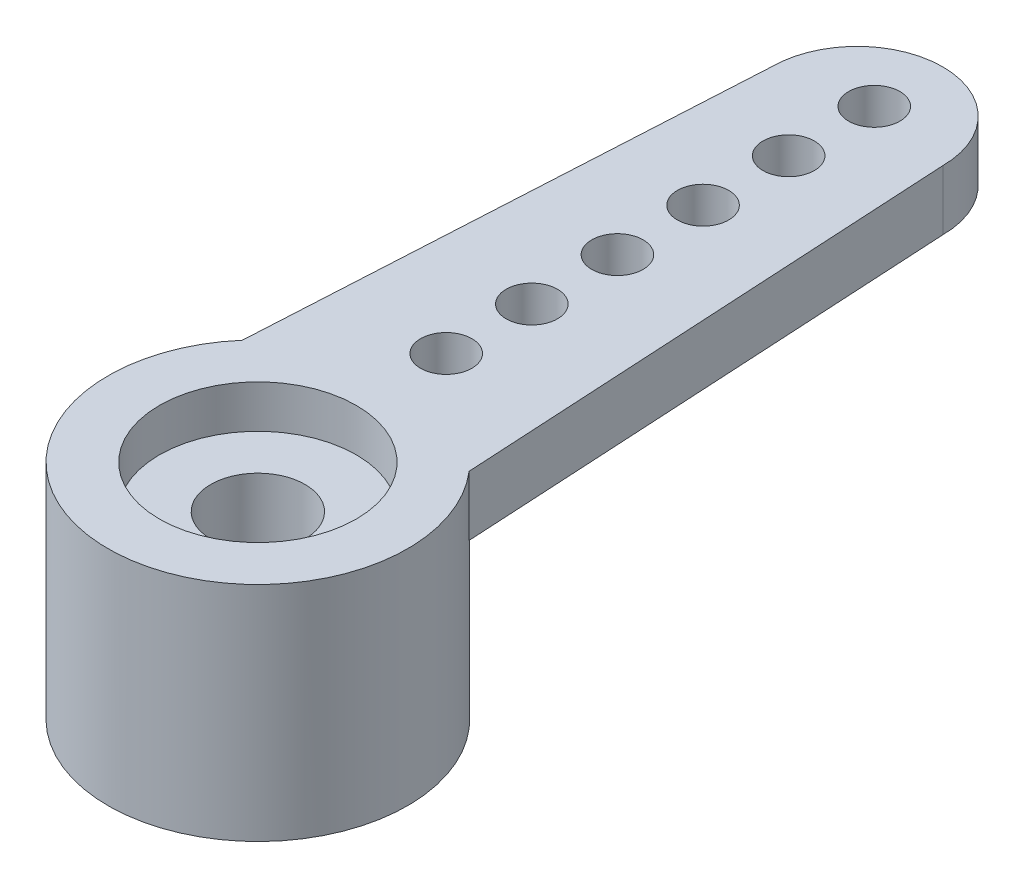
from build123d import *

# Parameters (mm, degrees)
BOSS_EXTRUDE1_DEPTH = 1.4
SKETCH2_R           = 3.5
BOSS_EXTRUDE2_DEPTH = 3.8
SKETCH3_R           = 2.3
CUT_EXTRUDE1_DEPTH  = 1
SKETCH4_R           = 2.5
CUT_EXTRUDE2_DEPTH  = 2
CUT_EXTRUDE3_REACH  = 18.908
SKETCH5_R           = 1.102182


with BuildPart() as part:
    # Sketch1 → Boss-Extrude1 (new body)
    with BuildSketch(Plane(origin=(0, 0, 0), x_dir=(1, 0, 0), z_dir=(0, 1, 0))):
        with BuildLine():
            ThreePointArc((2, 14), (0, 16), (-2, 14))
            Line((-2, 14), (-2.65, 2.286373))
            ThreePointArc((-2.65, 2.286373), (-2.286373, -2.65), (2.65, -2.286373))
            ThreePointArc((2.65, -2.286373), (3.5, 0), (2.65, 2.286373))
            Line((2.65, 2.286373), (2, 14))
        make_face()
        with BuildLine():
            ThreePointArc((0, 3.8), (-0.6, 4.4), (0, 5))
            ThreePointArc((0, 5), (0.424264, 4.824264), (0.6, 4.4))
            ThreePointArc((0.6, 4.4), (0.424264, 3.975736), (0, 3.8))
        make_face(mode=Mode.SUBTRACT)
        with BuildLine():
            ThreePointArc((0, 5.8), (-0.6, 6.4), (0, 7))
            ThreePointArc((0, 7), (0.424264, 6.824264), (0.6, 6.4))
            ThreePointArc((0.6, 6.4), (0.424264, 5.975736), (0, 5.8))
        make_face(mode=Mode.SUBTRACT)
        with BuildLine():
            ThreePointArc((0, 7.8), (-0.6, 8.4), (0, 9))
            ThreePointArc((0, 9), (0.424264, 8.824264), (0.6, 8.4))
            ThreePointArc((0.6, 8.4), (0.424264, 7.975736), (0, 7.8))
        make_face(mode=Mode.SUBTRACT)
        with BuildLine():
            ThreePointArc((0, 9.8), (-0.6, 10.4), (0, 11))
            ThreePointArc((0, 11), (0.424264, 10.824264), (0.6, 10.4))
            ThreePointArc((0.6, 10.4), (0.424264, 9.975736), (0, 9.8))
        make_face(mode=Mode.SUBTRACT)
        with BuildLine():
            ThreePointArc((0, 11.8), (-0.6, 12.4), (0, 13))
            ThreePointArc((0, 13), (0.424264, 12.824264), (0.6, 12.4))
            ThreePointArc((0.6, 12.4), (0.424264, 11.975736), (0, 11.8))
        make_face(mode=Mode.SUBTRACT)
        with BuildLine():
            ThreePointArc((0.6, 14.4), (0.424264, 13.975736), (0, 13.8))
            ThreePointArc((0, 13.8), (-0.424264, 14.824264), (0.6, 14.4))
        make_face(mode=Mode.SUBTRACT)
    extrude(amount=-BOSS_EXTRUDE1_DEPTH)

    # Sketch2 → Boss-Extrude2 (add)
    with BuildSketch(Plane(origin=(0, -1.4, 0), x_dir=(-1, 0, 0), z_dir=(0, -1, 0))):
        with Locations(Location((0, 0, 0), (0, 0, 139.212962))):
            Circle(SKETCH2_R)
    extrude(amount=BOSS_EXTRUDE2_DEPTH)

    # Sketch3 → Cut-Extrude1 (cut)
    with BuildSketch(Plane(origin=(0, 0, 0), x_dir=(1, 0, 0), z_dir=(0, 1, 0))):
        with Locations(Location((0, 0, 0), (0, 0, 270))):
            Circle(SKETCH3_R)
    extrude(amount=-CUT_EXTRUDE1_DEPTH, mode=Mode.SUBTRACT)

    # Sketch4 → Cut-Extrude2 (cut)
    with BuildSketch(Plane(origin=(0, -5.2, 0), x_dir=(-1, 0, 0), z_dir=(0, -1, 0))):
        with Locations(Location((0, 0, 0), (0, 0, 90))):
            Circle(SKETCH4_R)
    extrude(amount=-CUT_EXTRUDE2_DEPTH, mode=Mode.SUBTRACT)

    # Sketch5 → Cut-Extrude3 (cut, up to next)
    with BuildSketch(Plane(origin=(0, -1, 0), x_dir=(1, 0, 0), z_dir=(0, 1, 0)), mode=Mode.PRIVATE) as cut_extrude3_sk1:
        with Locations(Location((0, 0, 0), (0, 0, 270))):
            Circle(SKETCH5_R)
    cut_extrude3_tool1 = extrude(cut_extrude3_sk1.sketch, amount=-CUT_EXTRUDE3_REACH, mode=Mode.PRIVATE) & part.part
    add(cut_extrude3_tool1.solids().sort_by_distance((0, -1, 0))[0], mode=Mode.SUBTRACT)


solid = part.part
